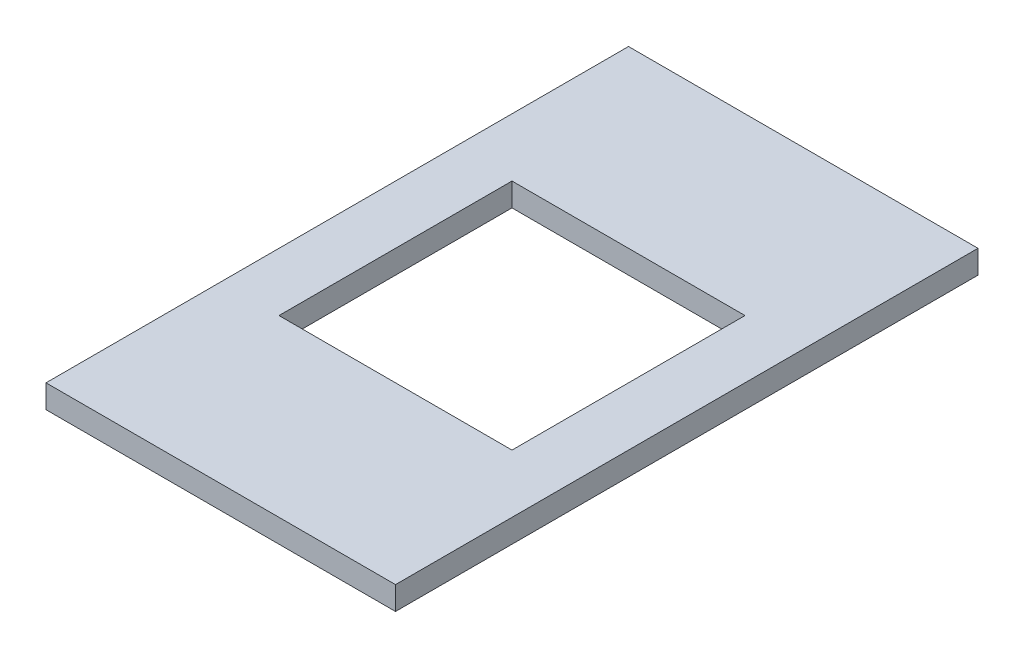
from build123d import *

# Parameters (mm, degrees)
SKETCH1_W           = 150
SKETCH1_H           = 30
BOSS_EXTRUDE1_DEPTH = 10
SKETCH9_W           = 150
SKETCH9_H           = 250
SKETCH9_W_2         = 100
SKETCH9_H_2         = 100
BOSS_EXTRUDE3_DEPTH = 10
SKETCH25_W          = 150
SKETCH25_H          = 30
CUT_EXTRUDE2_DEPTH  = 10


with BuildPart() as part:
    # Sketch1 → Boss-Extrude1 (new body)
    with BuildSketch(Plane(origin=(0, 0, 0), x_dir=(1, 0, 0), z_dir=(0, 1, 0))):
        with Locations((-75, 15)):
            Rectangle(SKETCH1_W, SKETCH1_H)
    extrude(amount=BOSS_EXTRUDE1_DEPTH)

    # Sketch9 → Boss-Extrude3 (add)
    with BuildSketch(Plane.XZ):
        with Locations((-75, -15)):
            Rectangle(SKETCH9_W, SKETCH9_H)
        with Locations((-75, -15)):
            Rectangle(SKETCH9_W_2, SKETCH9_H_2, mode=Mode.SUBTRACT)
    extrude(amount=BOSS_EXTRUDE3_DEPTH)

    # Sketch25 → Cut-Extrude2 (cut)
    with BuildSketch(Plane(origin=(0, 0, 0), x_dir=(1, 0, 0), z_dir=(0, 1, 0))):
        with Locations((-75, 15)):
            Rectangle(SKETCH25_W, SKETCH25_H)
    extrude(amount=CUT_EXTRUDE2_DEPTH, mode=Mode.SUBTRACT)


solid = part.part
